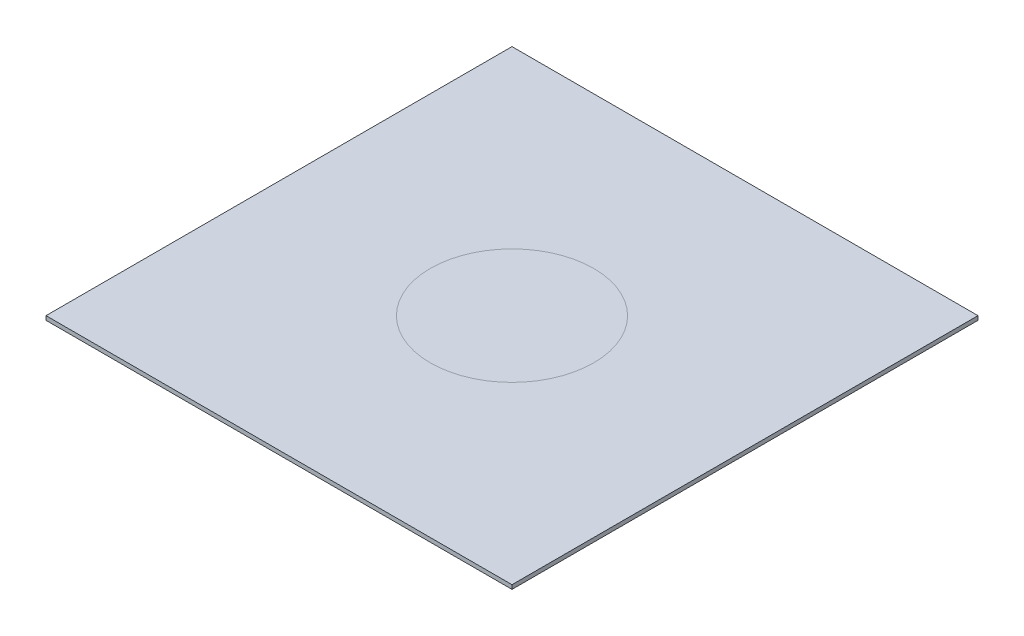
from build123d import *

# Parameters (mm, degrees)
SKETCH1_W           = 114
SKETCH1_H           = 114
BOSS_EXTRUDE1_DEPTH = 0.5


with BuildPart() as part:
    # Sketch1 → Boss-Extrude1 (new, symmetric)
    with BuildSketch(Plane(origin=(0, 0, 0), x_dir=(1, 0, 0), z_dir=(0, 1, 0))):
        Rectangle(SKETCH1_W, SKETCH1_H)
    extrude(amount=BOSS_EXTRUDE1_DEPTH, both=True)


solid = part.part
